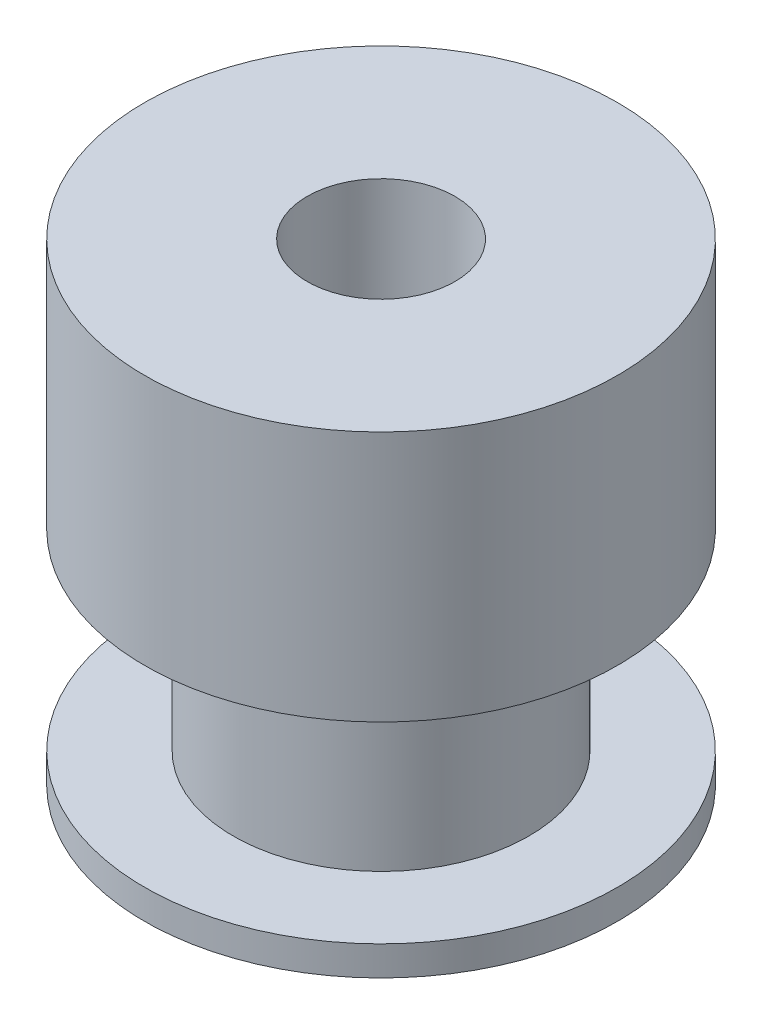
from build123d import *


with BuildPart() as part:
    # Sketch1 → Revolve1 (revolve)
    with BuildSketch(Plane.XY, mode=Mode.PRIVATE) as revolve1_sk:
        Polygon((2.5, -8), (2.5, 8), (8, 8), (8, -0.5), (5, -0.5), (5, -7), (8, -7), (8, -8), align=None)
    revolve(revolve1_sk.sketch.rotate(Axis((0, -4.881528906, 0), (0, 1, 0)), 90), axis=Axis((0, -4.881528906, 0), (0, 1, 0)))


solid = part.part
